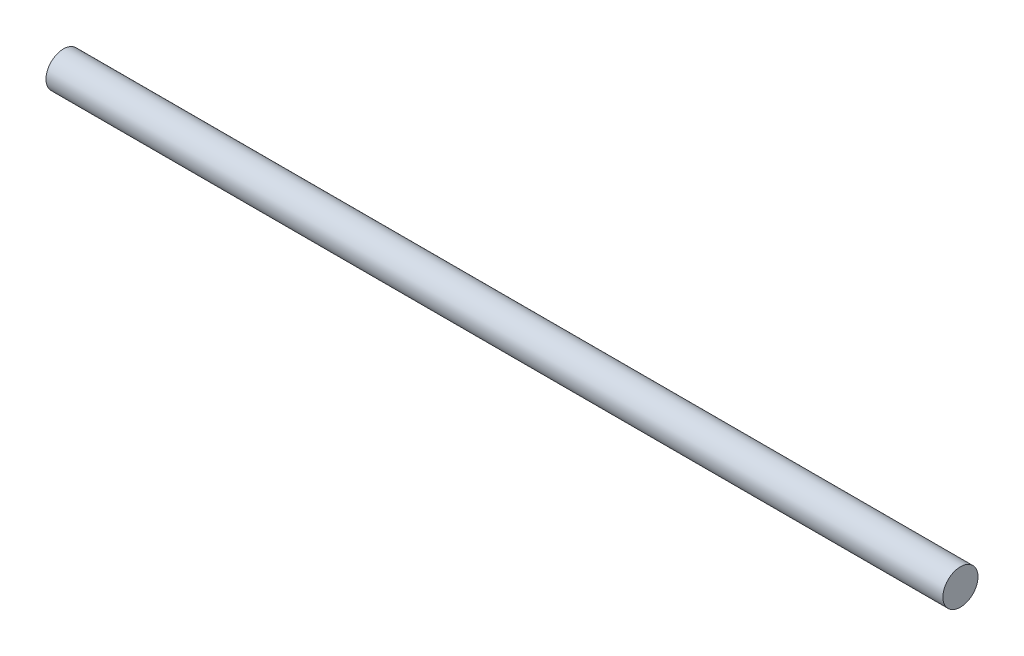
from build123d import *

# Parameters (mm, degrees)
SKETCH1_R           = 9
BOSS_EXTRUDE1_DEPTH = 230


with BuildPart() as part:
    # Sketch1 → Boss-Extrude1 (new, symmetric)
    with BuildSketch(Plane(origin=(0, 0, 0), x_dir=(0, 0, -1), z_dir=(1, 0, 0))):
        Circle(SKETCH1_R)
    extrude(amount=BOSS_EXTRUDE1_DEPTH, both=True)


solid = part.part
